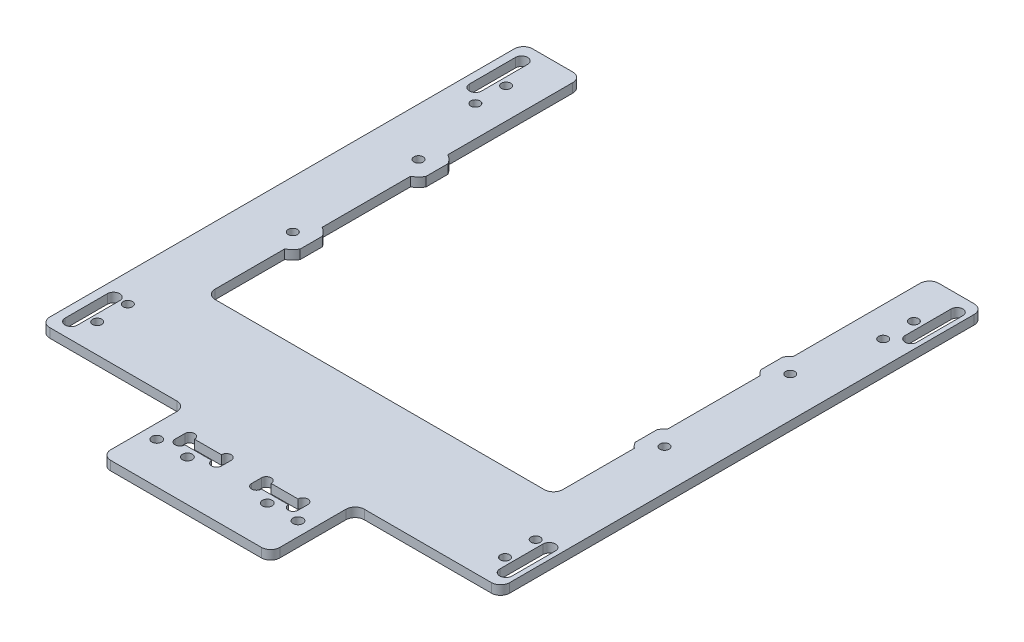
from build123d import *

# Parameters (mm, degrees)
SKETCH_1_R           = 1.6
EXTRUDE_1_DEPTH      = 3
SKETCH_5_W           = 8.427610272
SKETCH_5_H           = 29.562823711
CUT_EXTRUDE_4_DEPTH  = 10
SKETCH_7_W           = 55.144779456
SKETCH_7_H           = 10
CUT_EXTRUDE_1_DEPTH  = 100
CUT_EXTRUDE_5_DEPTH  = 100
CUT_EXTRUDE_6_DEPTH  = 100
FILLET_3_R           = 3
CUT_EXTRUDE_10_DEPTH = 10
EXTRUDE_2_DEPTH      = 3
FILLET_4_R           = 3
CUT_EXTRUDE_12_DEPTH = 3
SKETCH_18_R          = 1.5
CUT_EXTRUDE_13_DEPTH = 10
SKETCH_19_R          = 1.5
CUT_EXTRUDE_14_DEPTH = 10
SKETCH_22_R          = 1.5
SKETCH_22_W          = 106.4
SKETCH_22_H          = 92.5
CUT_EXTRUDE_15_DEPTH = 10
CUT_EXTRUDE_16_DEPTH = 10
FILLET_5_R           = 3
EXTRUDE_4_DEPTH      = 3
CUT_EXTRUDE_17_DEPTH = 45
SKETCH_26_R          = 1.5
CUT_EXTRUDE_18_DEPTH = 45
SKETCH_28_R          = 1.5
CUT_EXTRUDE_19_DEPTH = 45


with BuildPart() as part:
    # 草图1 → 凸台-拉伸1 (new body)
    with BuildSketch(Plane(origin=(0, 0, 0), x_dir=(1, 0, 0), z_dir=(0, 1, 0))):
        Polygon((-1, -77.5), (-40, -77.5), (-40, -235.15), (110, -235.15), (110, -77.5), (71, -77.5), (71, -47.937176289), (113.89906921, -47.937176289), (113.89906921, 47.937176289), (71, 47.937176289), (71, 77.5), (110, 77.5), (110, 235.15), (-40, 235.15), (-40, 77.5), (-1, 77.5), (-1, 47.937176289), (-43.89906921, 47.937176289), (-43.89906921, -47.937176289), (-1, -47.937176289), align=None)
        with Locations(Location((48.025, -63.59, 0), (0, 0, 90))):
            Circle(SKETCH_1_R, mode=Mode.SUBTRACT)
        with Locations(Location((58.025, -63.59, 0), (0, 0, 90))):
            Circle(SKETCH_1_R, mode=Mode.SUBTRACT)
        with Locations(Location((58.025, 63.41, 0), (0, 0, 90))):
            Circle(SKETCH_1_R, mode=Mode.SUBTRACT)
        with Locations(Location((48.025, 63.41, 0), (0, 0, 90))):
            Circle(SKETCH_1_R, mode=Mode.SUBTRACT)
        with Locations(Location((11.975, -63.59, 0), (0, 0, 270))):
            Circle(SKETCH_1_R, mode=Mode.SUBTRACT)
        with Locations(Location((21.975, -63.59, 0), (0, 0, 270))):
            Circle(SKETCH_1_R, mode=Mode.SUBTRACT)
        with Locations(Location((21.975, 63.41, 0), (0, 0, 270))):
            Circle(SKETCH_1_R, mode=Mode.SUBTRACT)
        with Locations(Location((11.975, 63.41, 0), (0, 0, 270))):
            Circle(SKETCH_1_R, mode=Mode.SUBTRACT)
        with BuildLine():
            Line((30.075, -69.59), (30.075, -66.41))
            ThreePointArc((30.075, -66.41), (28.475, -64.81), (26.875, -66.41))
            Line((26.875, -66.41), (18.125, -66.41))
            ThreePointArc((18.125, -66.41), (16.525, -64.81), (14.925, -66.41))
            Line((14.925, -66.41), (14.925, -69.59))
            ThreePointArc((14.925, -69.59), (16.525, -71.19), (18.125, -69.59))
            Line((18.125, -69.59), (26.875, -69.59))
            ThreePointArc((26.875, -69.59), (28.475, -71.19), (30.075, -69.59))
        make_face(mode=Mode.SUBTRACT)
        with BuildLine():
            Line((43.125, 69.59), (51.875, 69.59))
            ThreePointArc((51.875, 69.59), (53.475, 71.19), (55.075, 69.59))
            Line((55.075, 69.59), (55.075, 66.41))
            ThreePointArc((55.075, 66.41), (53.475, 64.81), (51.875, 66.41))
            Line((51.875, 66.41), (43.125, 66.41))
            ThreePointArc((43.125, 66.41), (41.525, 64.81), (39.925, 66.41))
            Line((39.925, 66.41), (39.925, 69.59))
            ThreePointArc((39.925, 69.59), (41.525, 71.19), (43.125, 69.59))
        make_face(mode=Mode.SUBTRACT)
        with BuildLine():
            Line((55.075, -69.59), (55.075, -66.41))
            ThreePointArc((55.075, -66.41), (53.475, -64.81), (51.875, -66.41))
            Line((51.875, -66.41), (43.125, -66.41))
            ThreePointArc((43.125, -66.41), (41.525, -64.81), (39.925, -66.41))
            Line((39.925, -66.41), (39.925, -69.59))
            ThreePointArc((39.925, -69.59), (41.525, -71.19), (43.125, -69.59))
            Line((43.125, -69.59), (51.875, -69.59))
            ThreePointArc((51.875, -69.59), (53.475, -71.19), (55.075, -69.59))
        make_face(mode=Mode.SUBTRACT)
        with BuildLine():
            Line((14.925, 69.59), (14.925, 66.41))
            ThreePointArc((14.925, 66.41), (16.525, 64.81), (18.125, 66.41))
            Line((18.125, 66.41), (26.875, 66.41))
            ThreePointArc((26.875, 66.41), (28.475, 64.81), (30.075, 66.41))
            Line((30.075, 66.41), (30.075, 69.59))
            ThreePointArc((30.075, 69.59), (28.475, 71.19), (26.875, 69.59))
            Line((26.875, 69.59), (18.125, 69.59))
            ThreePointArc((18.125, 69.59), (16.525, 71.19), (14.925, 69.59))
        make_face(mode=Mode.SUBTRACT)
    extrude(amount=EXTRUDE_1_DEPTH)

    # 草图5 → 切除-拉伸4 (cut)
    with BuildSketch(Plane.XZ):
        with Locations((66.786194864, 62.718588145)):
            Rectangle(SKETCH_5_W, SKETCH_5_H)
        with Locations((3.213805136, 62.718588145)):
            Rectangle(SKETCH_5_W, SKETCH_5_H)
        with Locations((3.213805136, -62.718588145)):
            Rectangle(SKETCH_5_W, SKETCH_5_H)
        with Locations((66.786194864, -62.718588145)):
            Rectangle(SKETCH_5_W, SKETCH_5_H)
    extrude(amount=-CUT_EXTRUDE_4_DEPTH, mode=Mode.SUBTRACT)

    # 草图7 → 切除-拉伸-薄壁1 (cut)
    with BuildSketch(Plane(origin=(0, 0, 0), x_dir=(-1, 0, 0), z_dir=(0, -1, 0))):
        with Locations((-35, -55.277176289)):
            Rectangle(SKETCH_7_W, SKETCH_7_H)
        Polygon((-113.89906921, -0.33), (-113.89906921, 47.607176289), (-62.572389728, 47.607176289), (-62.572389728, 49.947176289), (-7.427610272, 49.947176289), (-7.427610272, 47.607176289), (43.89906921, 47.607176289), (43.89906921, -0.33), (33.89906921, -0.33), (33.89906921, 37.607176289), (-17.427610272, 37.607176289), (-17.427610272, 39.947176289), (-52.572389728, 39.947176289), (-52.572389728, 37.607176289), (-103.89906921, 37.607176289), (-103.89906921, -0.33), align=None)
    extrude(amount=-CUT_EXTRUDE_1_DEPTH, mode=Mode.SUBTRACT)


with BuildPart() as cut_extrude_1_piece_1:
    # of the separate pieces the step leaves, piece 1, a body of its own (cut_extrude_1_pieces)
    add(part.part.solids().sort_by_distance((7.427610272, 0, -77.5))[0])

    # 草图9 → 切除-拉伸6 (cut)
    with BuildSketch(Plane.XZ):
        Polygon((-40, -102.5), (110, -102.5), (124.211694431, -119.691261336), (154.987235789, -211.57345947), (124.211694431, -286.861832075), (-63.673505757, -270.701496299), (-75.556105593, -182.770257517), (-74.082044988, -165.632360403), align=None)
    extrude(amount=-CUT_EXTRUDE_6_DEPTH, mode=Mode.SUBTRACT)

    # 圆角3
    fillet_3_edges = [cut_extrude_1_piece_1.edges().sort_by_distance(p)[0] for p in [
        (110, 1.5, -77.5),
        (-40, 1.5, -77.5),
        (62.572389728, 1.5, -77.5),
        (7.427610272, 1.5, -77.5),
        (-40, 1.5, -102.5),
        (110, 1.5, -102.5),
        (7.427610272, 1.5, -49.947176289),
        (62.572389728, 1.5, -49.947176289),
    ]]
    fillet(fillet_3_edges, radius=FILLET_3_R)

    # 草图13 → 切除-拉伸10 (cut)
    with BuildSketch(Plane(origin=(0, 3, 0), x_dir=(1, 0, 0), z_dir=(0, 1, 0))):
        with BuildLine():
            Line((108.525358631, 96.847090499), (108.525358631, 82.717214218))
            ThreePointArc((108.525358631, 82.717214218), (106.525358631, 80.717214218), (104.525358631, 82.717214218))
            Line((104.525358631, 82.717214218), (104.525358631, 96.847090499))
            ThreePointArc((104.525358631, 96.847090499), (106.525358631, 98.847090499), (108.525358631, 96.847090499))
        make_face()
        with BuildLine():
            Line((-33.2031819, 96.494326464), (-33.2031819, 82.717214218))
            ThreePointArc((-33.2031819, 82.717214218), (-35.2031819, 80.717214218), (-37.2031819, 82.717214218))
            Line((-37.2031819, 82.717214218), (-37.2031819, 96.494326464))
            ThreePointArc((-37.2031819, 96.494326464), (-35.2031819, 98.494326464), (-33.2031819, 96.494326464))
        make_face()
    extrude(amount=-CUT_EXTRUDE_10_DEPTH, mode=Mode.SUBTRACT)

    # 草图14 → 凸台-拉伸2 (add)
    with BuildSketch(Plane(origin=(0, 3, 0), x_dir=(1, 0, 0), z_dir=(0, 1, 0))):
        with BuildLine():
            Line((110, 99.5), (110, 234.97))
            Line((110, 234.97), (-40, 234.97))
            Line((-40, 234.97), (-40, 99.5))
            ThreePointArc((-40, 99.5), (-39.121320344, 101.621320344), (-37, 102.5))
            Line((-37, 102.5), (107, 102.5))
            ThreePointArc((107, 102.5), (109.121320344, 101.621320344), (110, 99.5))
        make_face()
    extrude(amount=-EXTRUDE_2_DEPTH)

    # 圆角4
    fillet_4_edges = [cut_extrude_1_piece_1.edges().sort_by_distance(p)[0] for p in [
        (-40, 1.5, -234.97),
        (110, 1.5, -234.97),
    ]]
    fillet(fillet_4_edges, radius=FILLET_4_R)

    # 草图16 → 切除-拉伸12 (cut)
    with BuildSketch(Plane(origin=(0, 3, 0), x_dir=(1, 0, 0), z_dir=(0, 1, 0))):
        with BuildLine():
            Line((-33.409459462, 229.7502134), (-33.409459462, 214.7502134))
            ThreePointArc((-33.409459462, 214.7502134), (-35.397660639, 212.762012223), (-37.385861817, 214.7502134))
            Line((-37.385861817, 214.7502134), (-37.385861817, 229.7502134))
            ThreePointArc((-37.385861817, 229.7502134), (-35.397660639, 231.738414578), (-33.409459462, 229.7502134))
        make_face()
        with BuildLine():
            Line((108.513408836, 229.7502134), (108.513408836, 214.7502134))
            ThreePointArc((108.513408836, 214.7502134), (106.603153693, 212.839958258), (104.69289855, 214.7502134))
            Line((104.69289855, 214.7502134), (104.69289855, 229.7502134))
            ThreePointArc((104.69289855, 229.7502134), (106.603153693, 231.660468543), (108.513408836, 229.7502134))
        make_face()
    extrude(amount=-CUT_EXTRUDE_12_DEPTH, mode=Mode.SUBTRACT)

    # 草图18 → 切除-拉伸13 (cut)
    with BuildSketch(Plane(origin=(0, 3, 0), x_dir=(1, 0, 0), z_dir=(0, 1, 0))):
        with Locations(Location((102.103153693, 96.853143426, 0), (0, 0, 270))):
            Circle(SKETCH_18_R)
        with Locations(Location((102.103153693, 86.853143426, 0), (0, 0, 270))):
            Circle(SKETCH_18_R)
    extrude(amount=-CUT_EXTRUDE_13_DEPTH, mode=Mode.SUBTRACT)

    # 草图19 → 切除-拉伸14 (cut)
    with BuildSketch(Plane(origin=(0, 3, 0), x_dir=(1, 0, 0), z_dir=(0, 1, 0))):
        with Locations(Location((-30.897660639, 86.853143426, 0), (0, 0, 270))):
            Circle(SKETCH_19_R)
        with Locations(Location((-30.897660639, 96.853143426, 0), (0, 0, 270))):
            Circle(SKETCH_19_R)
    extrude(amount=-CUT_EXTRUDE_14_DEPTH, mode=Mode.SUBTRACT)

    # 草图22 → 切除-拉伸15 (cut)
    with BuildSketch(Plane.XZ):
        with Locations(Location((96.837405042, -185.135573162, 0), (0, 0, 270))):
            Circle(SKETCH_22_R)
        with Locations(Location((96.837405042, -144.135573162, 0), (0, 0, 270))):
            Circle(SKETCH_22_R)
        with Locations(Location((-24.370364421, -185.135573162, 0), (0, 0, 270))):
            Circle(SKETCH_22_R)
        with Locations(Location((-24.370364421, -144.135573162, 0), (0, 0, 270))):
            Circle(SKETCH_22_R)
        with Locations((35.733520311, -164.635573162)):
            Rectangle(SKETCH_22_W, SKETCH_22_H)
    extrude(amount=-CUT_EXTRUDE_15_DEPTH, mode=Mode.SUBTRACT)

    # 草图23 → 切除-拉伸16 (cut)
    with BuildSketch(Plane(origin=(0, 3, 0), x_dir=(1, 0, 0), z_dir=(0, 1, 0))):
        Polygon((-20.926479689, 216.717541525), (-20.926479689, 112.385573162), (92.393520311, 112.385573162), (92.393520311, 240.726264798), (-20.926479689, 240.726264798), align=None)
    extrude(amount=-CUT_EXTRUDE_16_DEPTH, mode=Mode.SUBTRACT)

    # 圆角5
    fillet_5_edges = [cut_extrude_1_piece_1.edges().sort_by_distance(p)[0] for p in [
        (-20.926479689, 1.5, -234.97),
        (92.393520311, 1.5, -234.97),
        (92.393520311, 1.5, -112.385573162),
        (-20.926479689, 1.5, -112.385573162),
    ]]
    fillet(fillet_5_edges, radius=FILLET_5_R)

    # 草图24 → 凸台-拉伸4 (add)
    with BuildSketch(Plane(origin=(0, 3, 0), x_dir=(1, 0, 0), z_dir=(0, 1, 0))):
        with BuildLine():
            Line((-20.926479689, 191.229804694), (-20.926479689, 179.041341631))
            ThreePointArc((-20.926479689, 179.041341631), (-17.370364421, 185.135573162), (-20.926479689, 191.229804694))
        make_face()
        with BuildLine():
            Line((-20.926479689, 150.229804694), (-20.926479689, 138.041341631))
            ThreePointArc((-20.926479689, 138.041341631), (-17.370364421, 144.135573162), (-20.926479689, 150.229804694))
        make_face()
        with BuildLine():
            Line((92.393520311, 190.544074664), (92.393520311, 179.727071661))
            ThreePointArc((92.393520311, 179.727071661), (89.837405042, 185.135573162), (92.393520311, 190.544074664))
        make_face()
        with BuildLine():
            Line((92.393520311, 149.544074664), (92.393520311, 138.727071661))
            ThreePointArc((92.393520311, 138.727071661), (89.837405042, 144.135573162), (92.393520311, 149.544074664))
        make_face()
    extrude(amount=-EXTRUDE_4_DEPTH)

    # 草图25 → 切除-拉伸17 (cut)
    with BuildSketch(Plane(origin=(0, 3, 0), x_dir=(1, 0, 0), z_dir=(0, 1, 0))):
        Polygon((-18.370364421, 193.473494041), (-18.370364421, 130.789227704), (90.837405042, 130.789227704), (90.837405042, 206.746263223), (-18.370364421, 206.746263223), align=None)
    extrude(amount=-CUT_EXTRUDE_17_DEPTH, mode=Mode.SUBTRACT)

    # 草图26 → 切除-拉伸18 (cut)
    with BuildSketch(Plane(origin=(0, 3, 0), x_dir=(1, 0, 0), z_dir=(0, 1, 0))):
        with Locations(Location((102.103153693, 210.19295838, 0), (0, 0, 270))):
            Circle(SKETCH_26_R)
        with Locations(Location((102.103153693, 220.19295838, 0), (0, 0, 270))):
            Circle(SKETCH_26_R)
    extrude(amount=-CUT_EXTRUDE_18_DEPTH, mode=Mode.SUBTRACT)

    # 草图28 → 切除-拉伸19 (cut)
    with BuildSketch(Plane(origin=(0, 3, 0), x_dir=(1, 0, 0), z_dir=(0, 1, 0))):
        with Locations(Location((-30.897660639, 210.19295838, 0), (0, 0, 270))):
            Circle(SKETCH_28_R)
        with Locations(Location((-30.897660639, 220.19295838, 0), (0, 0, 270))):
            Circle(SKETCH_28_R)
    extrude(amount=-CUT_EXTRUDE_19_DEPTH, mode=Mode.SUBTRACT)


with BuildPart() as cut_extrude_1_piece_2:
    # of the separate pieces the step leaves, piece 2, a body of its own (cut_extrude_1_pieces)
    add(part.part.solids().sort_by_distance((-40, 0, 77.5))[0])


with BuildPart() as cut_extrude_1_piece_3:
    # of the separate pieces the step leaves, piece 3, a body of its own (cut_extrude_1_pieces)
    add(part.part.solids().sort_by_distance((7.427610272, 0, 50.277176289))[0])


with BuildPart() as cut_extrude_1_piece_4:
    # of the separate pieces the step leaves, piece 4, a body of its own (cut_extrude_1_pieces)
    add(part.part.solids().sort_by_distance((113.89906921, 0, -47.607176289))[0])


with BuildPart() as cut_extrude_1_piece_5:
    # of the separate pieces the step leaves, piece 5, a body of its own (cut_extrude_1_pieces)
    add(part.part.solids().sort_by_distance((-43.89906921, 0, -47.937176289))[0])


with BuildPart() as cut_extrude_5_tool:
    # 草图8 → 切除-拉伸5 (new body)
    with BuildSketch(Plane(origin=(0, 0, 0), x_dir=(-1, 0, 0), z_dir=(0, -1, 0))):
        Polygon((78.212914253, 60.385355647), (0, 54.326624312), (-4.481912928, 51.672567956), (-7.938908088, 48.761414138), (-49.331876445, 46.578048774), (-63.52375131, 48.761414138), (-79.080229528, 55.85735157), (-126.563695568, 60.385355647), (-136.561762242, 25.020008622), (-185.509289936, -177.467896247), (-114.798778659, -331.741539621), (230.896230576, -266.427705394), (230.896230576, -108.933419225), (223.681342993, -70.746247105), align=None)
    extrude(amount=-CUT_EXTRUDE_5_DEPTH)


with BuildPart() as cut_extrude_1_piece_2_1:
    add(cut_extrude_1_piece_2.part)

    # 切除-拉伸5: cut by cut_extrude_5_tool
    add(cut_extrude_5_tool.part, mode=Mode.SUBTRACT)


with BuildPart() as cut_extrude_1_piece_3_1:
    add(cut_extrude_1_piece_3.part)

    # 切除-拉伸5: cut by cut_extrude_5_tool
    add(cut_extrude_5_tool.part, mode=Mode.SUBTRACT)


with BuildPart() as cut_extrude_1_piece_4_1:
    add(cut_extrude_1_piece_4.part)

    # 切除-拉伸5: cut by cut_extrude_5_tool
    add(cut_extrude_5_tool.part, mode=Mode.SUBTRACT)


with BuildPart() as cut_extrude_1_piece_5_1:
    add(cut_extrude_1_piece_5.part)

    # 切除-拉伸5: cut by cut_extrude_5_tool
    add(cut_extrude_5_tool.part, mode=Mode.SUBTRACT)


solid = cut_extrude_1_piece_1.part
